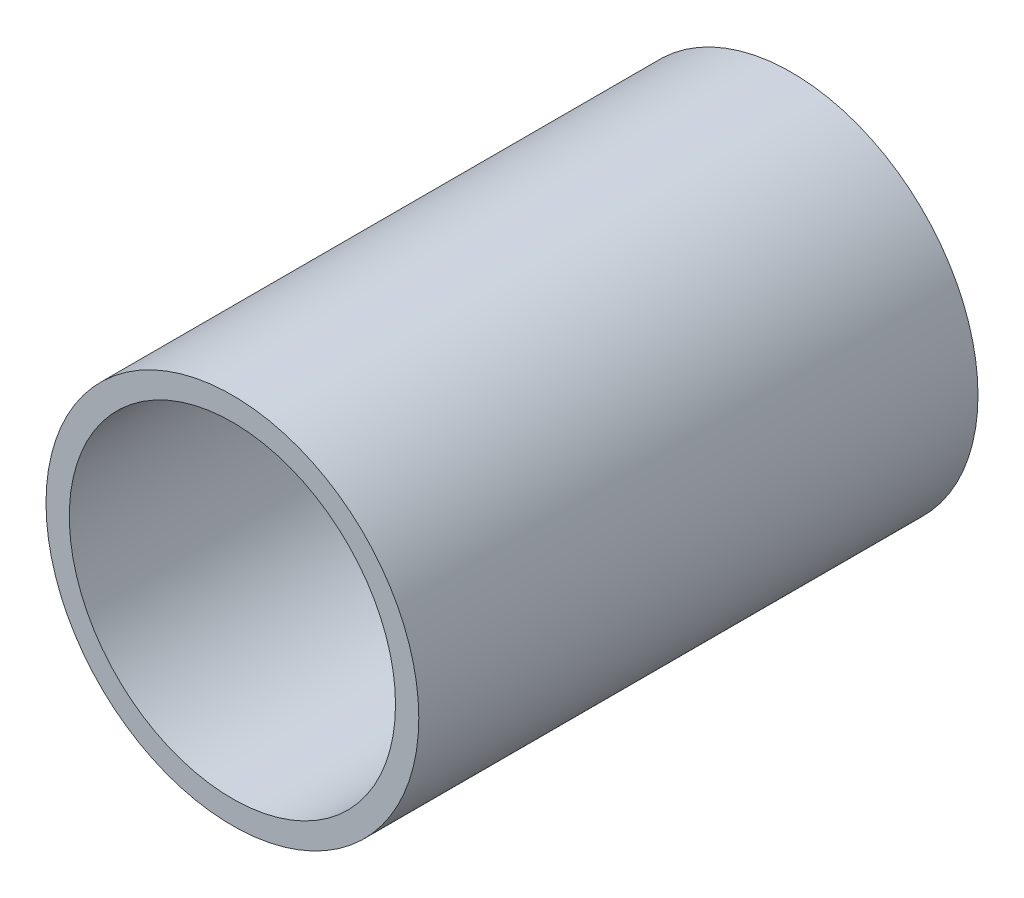
from build123d import *

# Parameters (mm, degrees)
ESBO_O2_R                = 8
ESBO_O2_R_2              = 7
RESSALTO_EXTRUS_O2_DEPTH = 24


with BuildPart() as part:
    # Esboço2 → Ressalto-extrusão2 (new body)
    with BuildSketch(Plane.XY):
        Circle(ESBO_O2_R)
        Circle(ESBO_O2_R_2, mode=Mode.SUBTRACT)
    extrude(amount=RESSALTO_EXTRUS_O2_DEPTH)


solid = part.part
